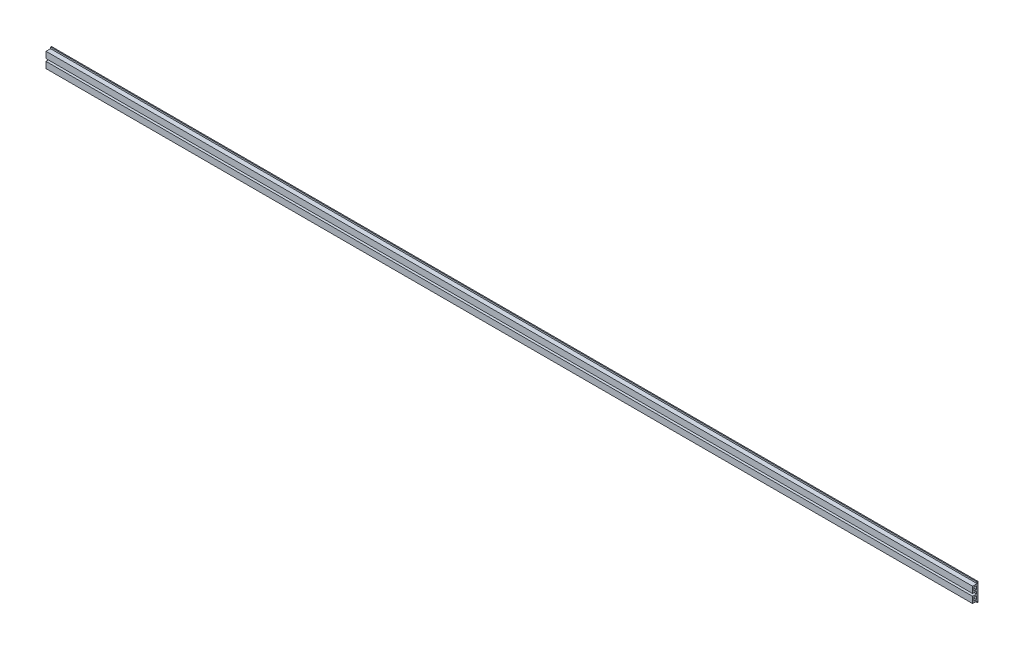
from build123d import *

# Parameters (mm, degrees)
SKETCH_1_W      = 8
SKETCH_1_H      = 11
EXTRUDE_1_DEPTH = 3080


with BuildPart() as part:
    # Эскиз1 → Бобышка-Вытянуть1 (new body)
    with BuildSketch(Plane(origin=(0, 0, 0), x_dir=(0, 0, -1), z_dir=(1, 0, 0))):
        Polygon((0, -30), (0, 30), (-3, 30), (-3, 25), (-18, 25), (-18, 4), (-5, 4), (-5, -4), (-18, -4), (-18, -25), (-3, -25), (-3, -30), align=None)
        with Locations((-9, 14.5)):
            Rectangle(SKETCH_1_W, SKETCH_1_H, mode=Mode.SUBTRACT)
        with Locations((-9, -14.5)):
            Rectangle(SKETCH_1_W, SKETCH_1_H, mode=Mode.SUBTRACT)
    extrude(amount=-EXTRUDE_1_DEPTH)


solid = part.part
